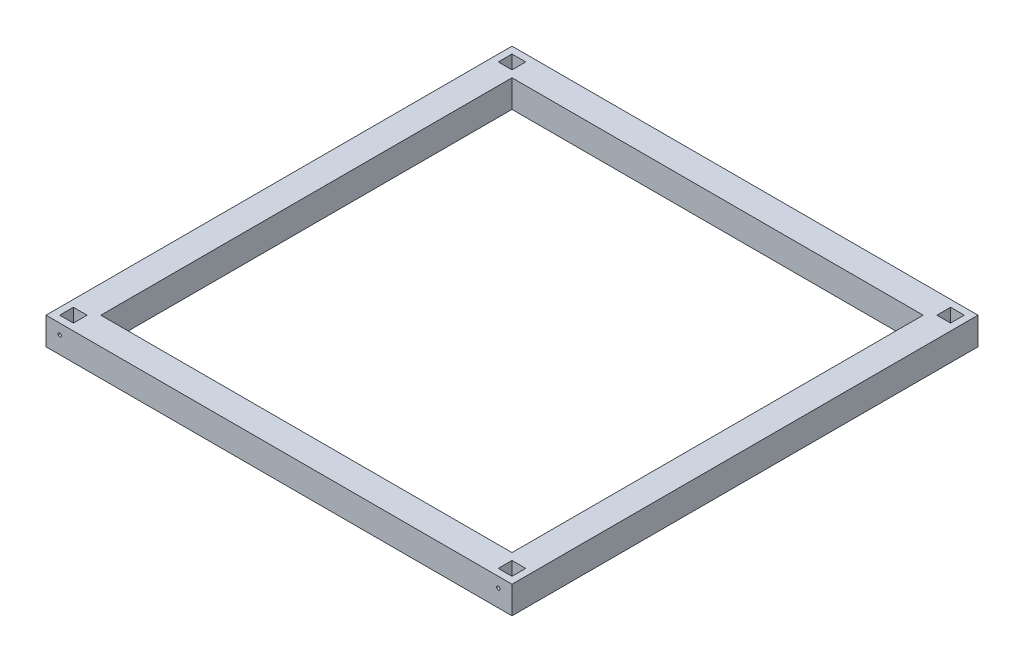
from build123d import *

# Parameters (mm, degrees)
SKETCH1_W           = 680
SKETCH1_H           = 680
SKETCH1_W_2         = 600
SKETCH1_H_2         = 600
BOSS_EXTRUDE1_DEPTH = 40
SKETCH2_W           = 20
SKETCH2_H           = 20
CUT_EXTRUDE2_DEPTH  = 30
SKETCH3_R           = 2.5
CUT_EXTRUDE3_DEPTH  = 40
CUT_EXTRUDE4_START  = -40
SKETCH4_R           = 2.5
CUT_EXTRUDE4_DEPTH  = 40


with BuildPart() as part:
    # Sketch1 → Boss-Extrude1 (new body)
    with BuildSketch(Plane(origin=(0, 0, 0), x_dir=(1, 0, 0), z_dir=(0, 1, 0))):
        Rectangle(SKETCH1_W, SKETCH1_H)
        Rectangle(SKETCH1_W_2, SKETCH1_H_2, mode=Mode.SUBTRACT)
    extrude(amount=BOSS_EXTRUDE1_DEPTH)

    # Sketch2 → Cut-Extrude2 (cut)
    with BuildSketch(Plane(origin=(0, 40, 0), x_dir=(1, 0, 0), z_dir=(0, 1, 0))):
        with Locations((-320.027392849, 320)):
            Rectangle(SKETCH2_W, SKETCH2_H)
        with Locations((319.972607151, 320)):
            Rectangle(SKETCH2_W, SKETCH2_H)
        with Locations((319.972607151, -320)):
            Rectangle(SKETCH2_W, SKETCH2_H)
        with Locations((-320.027392849, -320)):
            Rectangle(SKETCH2_W, SKETCH2_H)
    extrude(amount=-CUT_EXTRUDE2_DEPTH, mode=Mode.SUBTRACT)

    # Sketch3 → Cut-Extrude3 (cut)
    with BuildSketch(Plane(origin=(0, 0, -340), x_dir=(-1, 0, 0), z_dir=(0, 0, -1))):
        with Locations((320, 25)):
            Circle(SKETCH3_R)
        with Locations((-320, 25)):
            Circle(SKETCH3_R)
    extrude(amount=-CUT_EXTRUDE3_DEPTH, mode=Mode.SUBTRACT)

    # Sketch4 → Cut-Extrude4 (cut)
    with BuildSketch(Plane.XY.offset(340).offset(CUT_EXTRUDE4_START)):
        with Locations(Location((-320, 25, 0), (0, 0, 180))):
            Circle(SKETCH4_R)
        with Locations(Location((320, 25, 0), (0, 0, 180))):
            Circle(SKETCH4_R)
    extrude(amount=CUT_EXTRUDE4_DEPTH, mode=Mode.SUBTRACT)


solid = part.part
